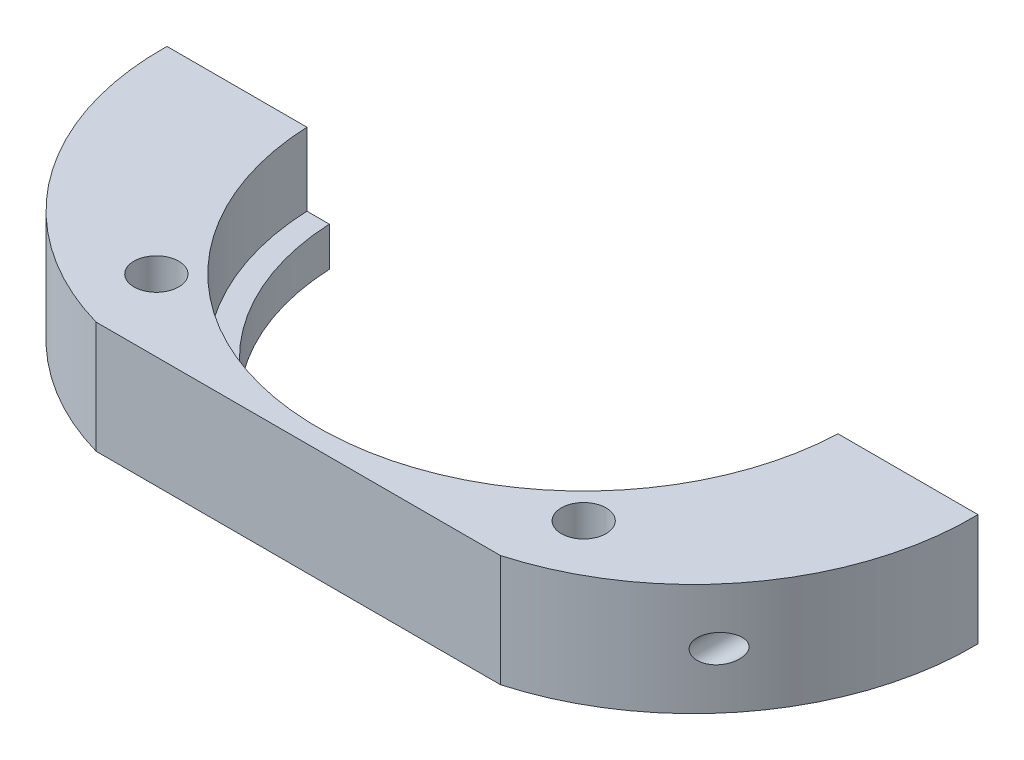
from build123d import *

# Parameters (mm, degrees)
SKETCH1_R                   = 62.5
SKETCH1_R_2                 = 43.5
BOSS_EXTRUDE1_DEPTH         = 20
SKETCH2_R                   = 47.5
CUT_EXTRUDE1_DEPTH          = 13
SKETCH3_R                   = 4
CUT_EXTRUDE2_DEPTH          = 91.622844802
SKETCH4_W                   = 150
SKETCH4_H                   = 64.5
SKETCH4_W_2                 = 72.256487598
SKETCH4_H_2                 = 11.5
CUT_EXTRUDE3_DEPTH          = 91.622844802
BOSS_EXTRUDE4_DEPTH         = 20
SKETCH7_R                   = 2.5
CUT_EXTRUDE4_DEPTH          = 90.742875716
M8_TAPPED_HOLE1_D           = 6.8
M8_TAPPED_HOLE1_DEPTH       = 38.75
M8_TAPPED_HOLE1_CSINK_D     = 8.05
M8_TAPPED_HOLE1_CSINK_ANGLE = 90
M8_TAPPED_HOLE1_TIP         = 2.042926105
M8_TAPPED_HOLE2_D           = 6.8
M8_TAPPED_HOLE2_DEPTH       = 19.75
M8_TAPPED_HOLE2_CSINK_D     = 8.05
M8_TAPPED_HOLE2_CSINK_ANGLE = 90
M8_TAPPED_HOLE2_TIP         = 2.042926105


with BuildPart() as part:
    # Sketch1 → Boss-Extrude1 (new body)
    with BuildSketch(Plane(origin=(0, 0, 0), x_dir=(1, 0, 0), z_dir=(0, 1, 0))):
        with Locations(Location((0, 0, 0), (0, 0, 270))):
            Circle(SKETCH1_R)
        with Locations(Location((0, 0, 0), (0, 0, 270))):
            Circle(SKETCH1_R_2, mode=Mode.SUBTRACT)
    extrude(amount=BOSS_EXTRUDE1_DEPTH)

    # Sketch2 → Cut-Extrude1 (cut)
    with BuildSketch(Plane(origin=(0, 20, 0), x_dir=(1, 0, 0), z_dir=(0, 1, 0))):
        with Locations(Location((0, 0, 0), (0, 0, 270))):
            Circle(SKETCH2_R)
    extrude(amount=-CUT_EXTRUDE1_DEPTH, mode=Mode.SUBTRACT)

    # Sketch3 → Cut-Extrude2 (cut, through all)
    with BuildSketch(Plane(origin=(0, 20, 0), x_dir=(1, 0, 0), z_dir=(0, 1, 0))):
        with Locations(Location((38.183766184, 38.183766184, 0), (0, 0, 270))):
            Circle(SKETCH3_R)
        with Locations(Location((38.183766184, -38.183766184, 0), (0, 0, 270))):
            Circle(SKETCH3_R)
        with Locations(Location((-38.183766184, -38.183766184, 0), (0, 0, 270))):
            Circle(SKETCH3_R)
        with Locations(Location((-38.183766184, 38.183766184, 0), (0, 0, 270))):
            Circle(SKETCH3_R)
    extrude(amount=-CUT_EXTRUDE2_DEPTH, mode=Mode.SUBTRACT)

    # Sketch4 → Cut-Extrude3 (cut, through all)
    with BuildSketch(Plane(origin=(0, 20, 0), x_dir=(1, 0, 0), z_dir=(0, 1, 0))):
        with Locations((0, 30.25)):
            Rectangle(SKETCH4_W, SKETCH4_H)
        with Locations((0, -56.75)):
            Rectangle(SKETCH4_W_2, SKETCH4_H_2)
    extrude(amount=-CUT_EXTRUDE3_DEPTH, mode=Mode.SUBTRACT)

    # Sketch6 → Boss-Extrude4 (add, through all)
    with BuildSketch(Plane(origin=(0, 20, 0), x_dir=(1, 0, 0), z_dir=(0, 1, 0))):
        with BuildLine():
            Line((-62.467991804, -2), (-72.467991804, -2))
            ThreePointArc((-72.467991804, -2), (-62.636910051, -32.684277735), (-36.128243799, -51))
            ThreePointArc((-36.128243799, -51), (-55.050471558, -29.592154049), (-62.467991804, -2))
        make_face()
        with BuildLine():
            ThreePointArc((62.467991804, -2), (55.050471558, -29.592154049), (36.128243799, -51))
            ThreePointArc((36.128243799, -51), (62.636910051, -32.684277735), (72.467991804, -2))
            Line((72.467991804, -2), (62.467991804, -2))
        make_face()
    extrude(amount=-BOSS_EXTRUDE4_DEPTH)

    # Sketch7 → Cut-Extrude4 (cut, through all)
    with BuildSketch(Plane(origin=(0, 0, 2), x_dir=(-1, 0, 0), z_dir=(0, 0, -1))):
        with Locations((-59.962933931, 10)):
            Circle(SKETCH7_R)
    extrude(amount=-CUT_EXTRUDE4_DEPTH, mode=Mode.SUBTRACT)

    # M8 Tapped Hole1
    with Locations(Plane(origin=(-59.962933931, 10, 2), x_dir=(-1, 0, 0), z_dir=(0, 0, -1))):
        with Locations((0, 0)):
            CounterSinkHole(M8_TAPPED_HOLE1_D / 2, M8_TAPPED_HOLE1_CSINK_D / 2, depth=M8_TAPPED_HOLE1_DEPTH, counter_sink_angle=M8_TAPPED_HOLE1_CSINK_ANGLE)
            with Locations((0, 0, -(M8_TAPPED_HOLE1_DEPTH + M8_TAPPED_HOLE1_TIP / 2))):  # 118° drill point
                Cone(0, M8_TAPPED_HOLE1_D / 2, M8_TAPPED_HOLE1_TIP, mode=Mode.SUBTRACT)

    # M8 Tapped Hole2
    with Locations(Plane(origin=(59.962933931, 10, 2), x_dir=(-1, 0, 0), z_dir=(0, 0, -1))):
        with Locations((0, 0)):
            CounterSinkHole(M8_TAPPED_HOLE2_D / 2, M8_TAPPED_HOLE2_CSINK_D / 2, depth=M8_TAPPED_HOLE2_DEPTH, counter_sink_angle=M8_TAPPED_HOLE2_CSINK_ANGLE)
            with Locations((0, 0, -(M8_TAPPED_HOLE2_DEPTH + M8_TAPPED_HOLE2_TIP / 2))):  # 118° drill point
                Cone(0, M8_TAPPED_HOLE2_D / 2, M8_TAPPED_HOLE2_TIP, mode=Mode.SUBTRACT)


solid = part.part
